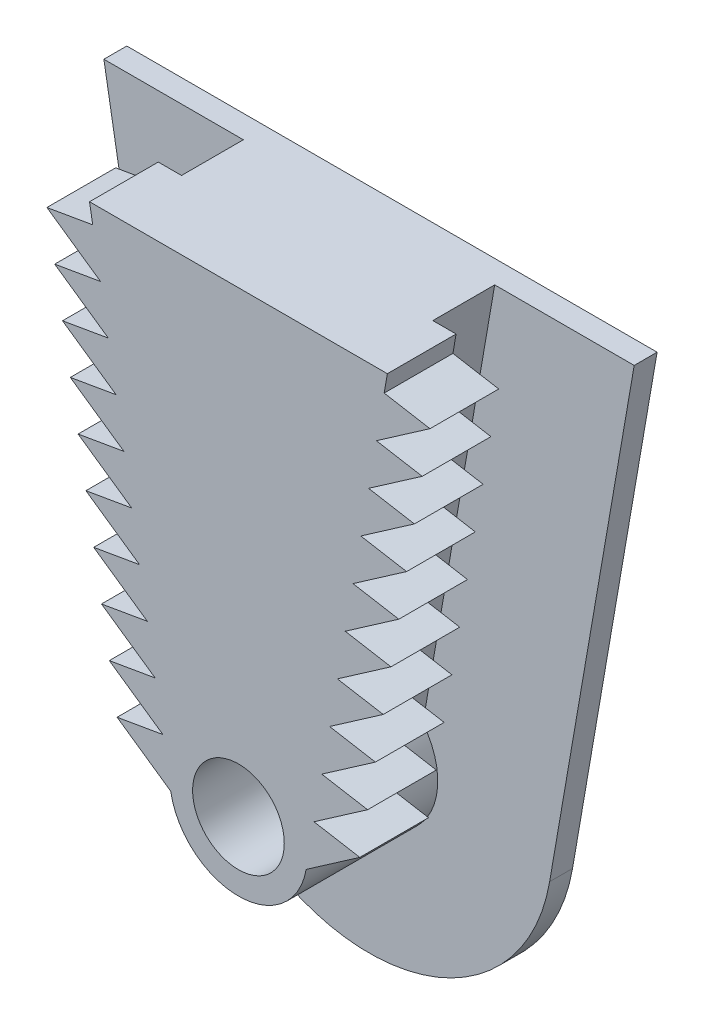
from build123d import *

# Parameters (mm, degrees)
BOSS_EXTRUDE1_DEPTH  = 1.905
BOSS_EXTRUDE3_DEPTH  = 3.429
BOSS_EXTRUDE2_DEPTH  = 3.81
LPATTERN1_COUNT      = 10
LPATTERN1_PITCH      = 2.54
MIRROR1_COPY_1_DEPTH = 3.81
MIRROR1_COPY_2_DEPTH = 3.81
MIRROR1_COPY_3_DEPTH = 3.81
MIRROR1_COPY_4_DEPTH = 3.81
MIRROR1_COPY_5_DEPTH = 3.81
MIRROR1_COPY_6_DEPTH = 3.81
MIRROR1_COPY_7_DEPTH = 3.81
MIRROR1_COPY_8_DEPTH = 3.81
MIRROR1_COPY_9_DEPTH = 3.81
BOSS_EXTRUDE4_DEPTH  = 1.27
SKETCH5_R            = 2.54
CUT_EXTRUDE1_DEPTH   = 31.555296323
SKETCH6_R            = 3.81
SKETCH6_R_2          = 2.54
BOSS_EXTRUDE5_DEPTH  = 7.62


with BuildPart() as part:
    # Sketch1 → Boss-Extrude1 (new, symmetric)
    with BuildSketch(Plane.XY):
        with BuildLine():
            Line((-3.754374137, -0.648671595), (-8.255, 25.4))
            Line((-8.255, 25.4), (8.255, 25.4))
            Line((8.255, 25.4), (3.754374137, -0.648671595))
            ThreePointArc((3.754374137, -0.648671595), (0, -3.81), (-3.754374137, -0.648671595))
        make_face()
    extrude(amount=BOSS_EXTRUDE1_DEPTH, both=True)

    # Sketch3 → Boss-Extrude3 (add)
    with BuildSketch(Plane(origin=(0, 0, -1.905), x_dir=(-1, 0, 0), z_dir=(0, 0, -1))):
        with BuildLine():
            Line((6.966183323, 25.4), (-6.966183323, 25.4))
            Line((-6.966183323, 25.4), (-2.502916091, -0.43244773))
            ThreePointArc((-2.502916091, -0.43244773), (0, -2.54), (2.502916091, -0.43244773))
            Line((2.502916091, -0.43244773), (6.966183323, 25.4))
        make_face()
    extrude(amount=BOSS_EXTRUDE3_DEPTH)

    # Sketch2 → Boss-Extrude2 (add)
    with BuildSketch(Plane.XY.offset(1.905)):
        Polygon((-3.754374137, -0.648671595), (-6.726821867, 1.4153895), (-4.186821867, 1.854244497), align=None)
    boss_extrude2 = extrude(amount=-BOSS_EXTRUDE2_DEPTH)

    # LPattern1: Boss-Extrude2 ×10
    with Locations(*[Vector(-0.17025501170659457, 0.9854000360202892, 0) * (i * LPATTERN1_PITCH) for i in range(1, LPATTERN1_COUNT)]):
        add(boss_extrude2)

    # Mirror1: Boss-Extrude2 across plane
    add(boss_extrude2.mirror(Plane(origin=(0, 0, 0), x_dir=(0, 0, 1), z_dir=(1, 0, 0))))

    # Mirror1 copy 1 sketch → Mirror1 copy 1 (add)
    with BuildSketch(Plane(origin=(0.43244773, 2.502916091, 1.905), x_dir=(-1, 0, 0), z_dir=(0, 0, 1))):
        Polygon((-3.754374137, 0.648671595), (-6.726821867, -1.4153895), (-4.186821867, -1.854244497), align=None)
    extrude(amount=-MIRROR1_COPY_1_DEPTH)

    # Mirror1 copy 2 sketch → Mirror1 copy 2 (add)
    with BuildSketch(Plane(origin=(0.864895459, 5.005832183, 1.905), x_dir=(-1, 0, 0), z_dir=(0, 0, 1))):
        Polygon((-3.754374137, 0.648671595), (-6.726821867, -1.4153895), (-4.186821867, -1.854244497), align=None)
    extrude(amount=-MIRROR1_COPY_2_DEPTH)

    # Mirror1 copy 3 sketch → Mirror1 copy 3 (add)
    with BuildSketch(Plane(origin=(1.297343189, 7.508748274, 1.905), x_dir=(-1, 0, 0), z_dir=(0, 0, 1))):
        Polygon((-3.754374137, 0.648671595), (-6.726821867, -1.4153895), (-4.186821867, -1.854244497), align=None)
    extrude(amount=-MIRROR1_COPY_3_DEPTH)

    # Mirror1 copy 4 sketch → Mirror1 copy 4 (add)
    with BuildSketch(Plane(origin=(1.729790919, 10.011664366, 1.905), x_dir=(-1, 0, 0), z_dir=(0, 0, 1))):
        Polygon((-3.754374137, 0.648671595), (-6.726821867, -1.4153895), (-4.186821867, -1.854244497), align=None)
    extrude(amount=-MIRROR1_COPY_4_DEPTH)

    # Mirror1 copy 5 sketch → Mirror1 copy 5 (add)
    with BuildSketch(Plane(origin=(2.162238649, 12.514580457, 1.905), x_dir=(-1, 0, 0), z_dir=(0, 0, 1))):
        Polygon((-3.754374137, 0.648671595), (-6.726821867, -1.4153895), (-4.186821867, -1.854244497), align=None)
    extrude(amount=-MIRROR1_COPY_5_DEPTH)

    # Mirror1 copy 6 sketch → Mirror1 copy 6 (add)
    with BuildSketch(Plane(origin=(2.594686378, 15.017496549, 1.905), x_dir=(-1, 0, 0), z_dir=(0, 0, 1))):
        Polygon((-3.754374137, 0.648671595), (-6.726821867, -1.4153895), (-4.186821867, -1.854244497), align=None)
    extrude(amount=-MIRROR1_COPY_6_DEPTH)

    # Mirror1 copy 7 sketch → Mirror1 copy 7 (add)
    with BuildSketch(Plane(origin=(3.027134108, 17.52041264, 1.905), x_dir=(-1, 0, 0), z_dir=(0, 0, 1))):
        Polygon((-3.754374137, 0.648671595), (-6.726821867, -1.4153895), (-4.186821867, -1.854244497), align=None)
    extrude(amount=-MIRROR1_COPY_7_DEPTH)

    # Mirror1 copy 8 sketch → Mirror1 copy 8 (add)
    with BuildSketch(Plane(origin=(3.459581838, 20.023328732, 1.905), x_dir=(-1, 0, 0), z_dir=(0, 0, 1))):
        Polygon((-3.754374137, 0.648671595), (-6.726821867, -1.4153895), (-4.186821867, -1.854244497), align=None)
    extrude(amount=-MIRROR1_COPY_8_DEPTH)

    # Mirror1 copy 9 sketch → Mirror1 copy 9 (add)
    with BuildSketch(Plane(origin=(3.892029568, 22.526244823, 1.905), x_dir=(-1, 0, 0), z_dir=(0, 0, 1))):
        Polygon((-3.754374137, 0.648671595), (-6.726821867, -1.4153895), (-4.186821867, -1.854244497), align=None)
    extrude(amount=-MIRROR1_COPY_9_DEPTH)

    # Sketch4 → Boss-Extrude4 (add)
    with BuildSketch(Plane(origin=(0, 0, -5.334), x_dir=(-1, 0, 0), z_dir=(0, 0, -1))):
        with BuildLine():
            Line((-14.699083385, 25.4), (14.699083385, 25.4))
            Line((14.699083385, 25.4), (14.474931597, 24.102656811))
            Line((14.474931597, 24.102656811), (10.011664366, -1.729790919))
            ThreePointArc((10.011664366, -1.729790919), (0, -10.16), (-10.011664366, -1.729790919))
            Line((-10.011664366, -1.729790919), (-14.474931597, 24.102656811))
            Line((-14.474931597, 24.102656811), (-14.699083385, 25.4))
        make_face()
    extrude(amount=BOSS_EXTRUDE4_DEPTH)

    # Sketch5 → Cut-Extrude1 (cut, through all)
    with BuildSketch(Plane.XY.offset(1.905)):
        Circle(SKETCH5_R)
    extrude(amount=-CUT_EXTRUDE1_DEPTH, mode=Mode.SUBTRACT)

    # Sketch6 → Boss-Extrude5 (add)
    with BuildSketch(Plane.XY.offset(1.905)):
        Circle(SKETCH6_R)
        Circle(SKETCH6_R_2, mode=Mode.SUBTRACT)
    extrude(amount=-BOSS_EXTRUDE5_DEPTH)


solid = part.part
